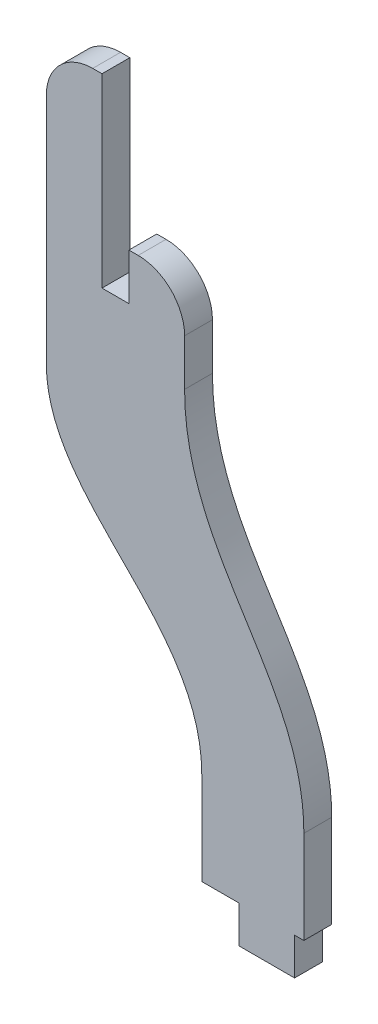
from build123d import *

# Parameters (mm, degrees)
SKETCH1_W           = 6
SKETCH1_H           = 4
BOSS_EXTRUDE1_DEPTH = 3
FILLET1_R           = 5


with BuildPart() as part:
    # Sketch1 → Boss-Extrude1 (new body)
    with BuildSketch(Plane.XY):
        with BuildLine():
            Line((0, 0), (-11, 0))
            Line((-11, 0), (-11, 10))
            add(Edge.make_bspline(
                [(-11, 10), (-11, 23.756315473), (-27.75, 27.611609377), (-27.75, 40)],
                knots=[0, 0, 0, 0, 1, 1, 1, 1], degree=3))
            Line((-27.75, 40), (-27.75, 70))
            Line((-27.75, 70), (-21.75, 70))
            Line((-21.75, 70), (-21.75, 50))
            Line((-21.75, 50), (-18.85, 50))
            Line((-18.85, 50), (-18.85, 55))
            Line((-18.85, 55), (-12.85, 55))
            Line((-12.85, 55), (-12.85, 45))
            add(Edge.make_bspline(
                [(-12.85, 45), (-12.85, 29.868343374), (0, 23.949472312), (0, 10)],
                knots=[0, 0, 0, 0, 1, 1, 1, 1], degree=3))
            Line((0, 10), (0, 0))
        make_face()
        with Locations((-4, -2)):
            Rectangle(SKETCH1_W, SKETCH1_H)
    extrude(amount=BOSS_EXTRUDE1_DEPTH)

    # Fillet1
    fillet1_edges = [part.edges().sort_by_distance(p)[0] for p in [
        (-27.75, 70, 1.5),
        (-12.85, 55, 1.5),
    ]]
    fillet(fillet1_edges, radius=FILLET1_R)


solid = part.part
